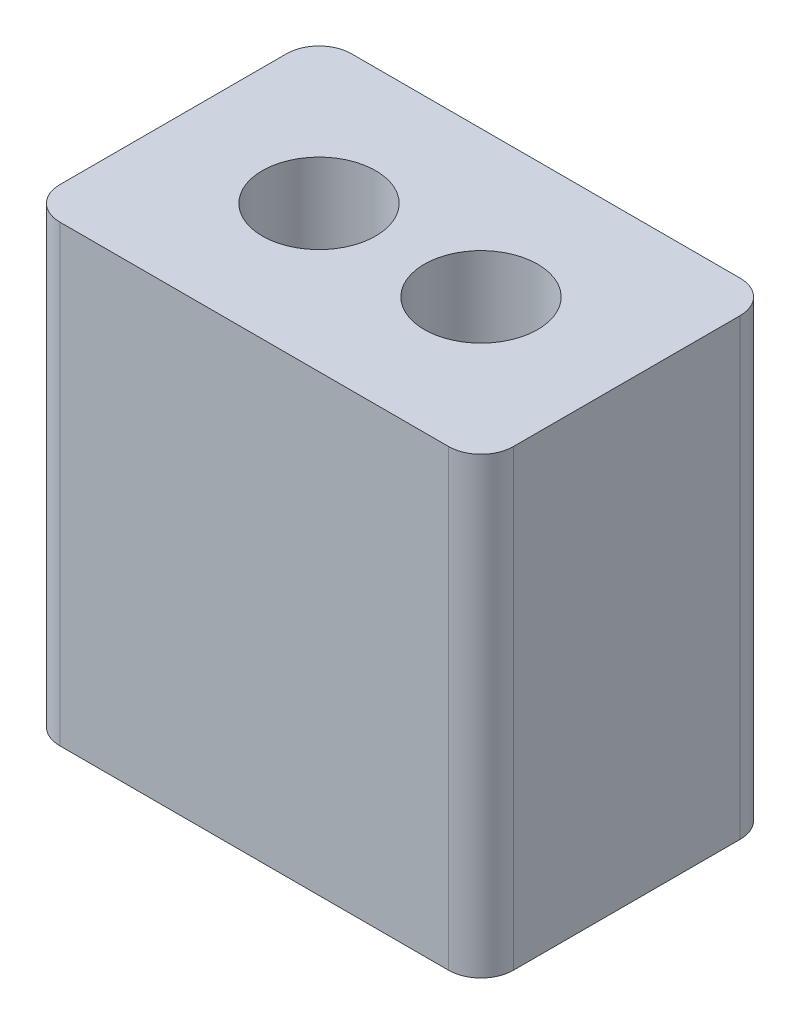
from build123d import *

# Parameters (mm, degrees)
SKETCH_1_W          = 14
SKETCH_1_H          = 9
EXTRUDE_1_DEPTH     = 14
FILLET_1_R          = 1
SKETCH_3_R          = 1.75
CUT_EXTRUDE_2_DEPTH = 7
CUT_EXTRUDE_3_REACH = 12.874
SKETCH_4_R          = 0.95


with BuildPart() as part:
    # 草图1 → 凸台-拉伸1 (new body)
    with BuildSketch(Plane(origin=(0, 0, 0), x_dir=(1, 0, 0), z_dir=(0, 1, 0))):
        Rectangle(SKETCH_1_W, SKETCH_1_H)
    extrude(amount=EXTRUDE_1_DEPTH)

    # 圆角1
    fillet_1_edges = [part.edges().sort_by_distance(p)[0] for p in [
        (7, 7, 4.5),
        (-7, 7, 4.5),
        (-7, 7, -4.5),
        (7, 7, -4.5),
    ]]
    fillet(fillet_1_edges, radius=FILLET_1_R)

    # 草图3 → 切除-拉伸2 (cut)
    with BuildSketch(Plane(origin=(0, 14, 0), x_dir=(1, 0, 0), z_dir=(0, 1, 0))):
        with Locations(Location((-2.5, 0, 0), (0, 0, 270))):
            Circle(SKETCH_3_R)
        with Locations(Location((2.5, 0, 0), (0, 0, 90))):
            Circle(SKETCH_3_R)
    extrude(amount=-CUT_EXTRUDE_2_DEPTH, mode=Mode.SUBTRACT)

    # 草图4 → 切除-拉伸3 (cut, up to next)
    with BuildSketch(Plane(origin=(0, 7, 0), x_dir=(1, 0, 0), z_dir=(0, 1, 0)), mode=Mode.PRIVATE) as cut_extrude_3_sk1:
        with Locations(Location((-2.5, 0, 0), (0, 0, 270))):
            Circle(SKETCH_4_R)
    cut_extrude_3_tool1 = extrude(cut_extrude_3_sk1.sketch, amount=-CUT_EXTRUDE_3_REACH, mode=Mode.PRIVATE) & part.part
    # 草图4 → 切除-拉伸3 (cut, up to next)
    with BuildSketch(Plane(origin=(0, 7, 0), x_dir=(1, 0, 0), z_dir=(0, 1, 0)), mode=Mode.PRIVATE) as cut_extrude_3_sk2:
        with Locations(Location((2.5, 0, 0), (0, 0, 270))):
            Circle(SKETCH_4_R)
    cut_extrude_3_tool2 = extrude(cut_extrude_3_sk2.sketch, amount=-CUT_EXTRUDE_3_REACH, mode=Mode.PRIVATE) & part.part
    add(cut_extrude_3_tool1.solids().sort_by_distance((-2.5, 7, 0))[0], mode=Mode.SUBTRACT)
    add(cut_extrude_3_tool2.solids().sort_by_distance((2.5, 7, 0))[0], mode=Mode.SUBTRACT)


solid = part.part
